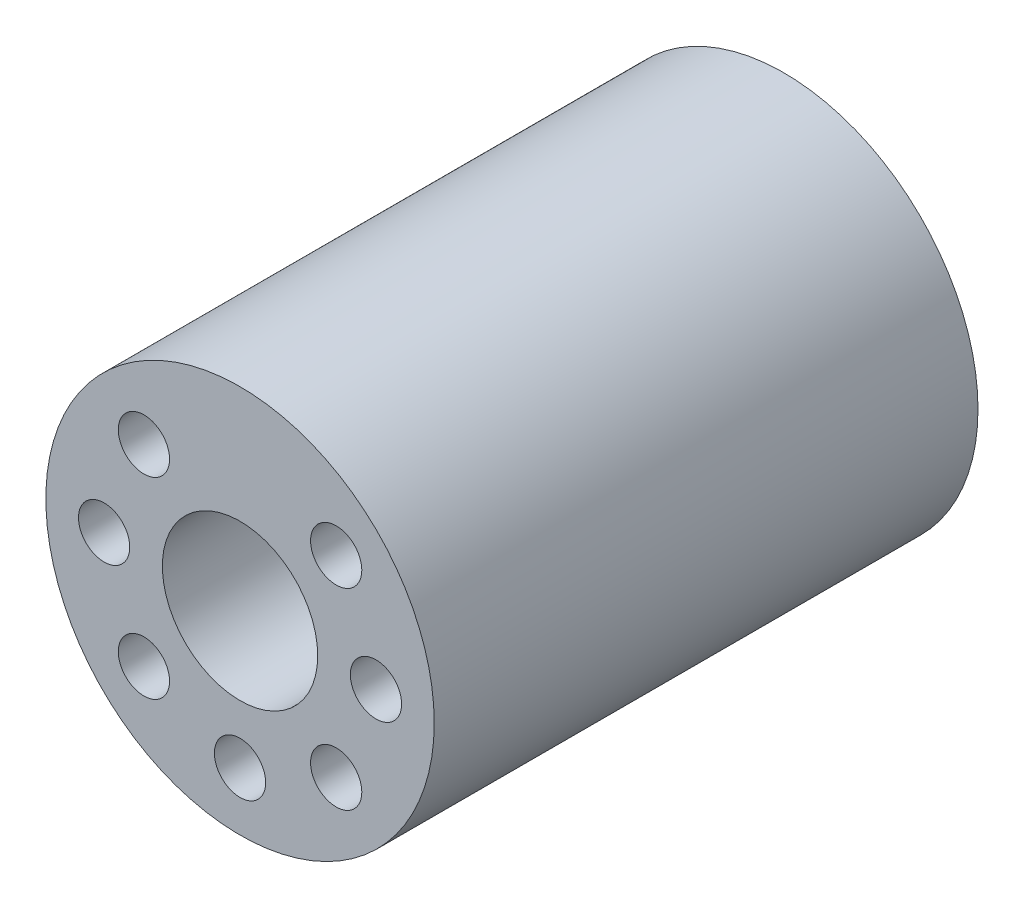
from build123d import *

# Parameters (mm, degrees)
SKETCH1_R           = 25
SKETCH1_R_2         = 10
BOSS_EXTRUDE1_DEPTH = 70
SKETCH3_R           = 3.3
CUT_EXTRUDE1_DEPTH  = 20
CUT_EXTRUDE2_START  = -20
SKETCH4_R           = 3.3
CUT_EXTRUDE2_DEPTH  = 20


with BuildPart() as part:
    # Sketch1 → Boss-Extrude1 (new body)
    with BuildSketch(Plane.XY):
        Circle(SKETCH1_R)
        Circle(SKETCH1_R_2, mode=Mode.SUBTRACT)
    extrude(amount=BOSS_EXTRUDE1_DEPTH)

    # Sketch3 → Cut-Extrude1 (cut)
    with BuildSketch(Plane.XY.offset(70)):
        with Locations((12.374368671, 12.374368671)):
            Circle(SKETCH3_R)
        with Locations((17.5, 0)):
            Circle(SKETCH3_R)
        with Locations((12.374368671, -12.374368671)):
            Circle(SKETCH3_R)
        with Locations((0, -17.5)):
            Circle(SKETCH3_R)
        with Locations((-12.374368671, -12.374368671)):
            Circle(SKETCH3_R)
        with Locations((-17.5, 0)):
            Circle(SKETCH3_R)
        with Locations((-12.374368671, 12.374368671)):
            Circle(SKETCH3_R)
    extrude(amount=-CUT_EXTRUDE1_DEPTH, mode=Mode.SUBTRACT)

    # Sketch4 → Cut-Extrude2 (cut)
    with BuildSketch(Plane(origin=(0, 0, 0), x_dir=(-1, 0, 0), z_dir=(0, 0, -1)).offset(CUT_EXTRUDE2_START)):
        with Locations((0, 17.5)):
            Circle(SKETCH4_R)
        with Locations(Location((12.374368671, 12.374368671, 0), (0, 0, 180))):
            Circle(SKETCH4_R)
        with Locations(Location((17.5, 0, 0), (0, 0, 180))):
            Circle(SKETCH4_R)
        with Locations(Location((12.374368671, -12.374368671, 0), (0, 0, 180))):
            Circle(SKETCH4_R)
        with Locations(Location((0, -17.5, 0), (0, 0, 180))):
            Circle(SKETCH4_R)
        with Locations(Location((-12.374368671, -12.374368671, 0), (0, 0, 180))):
            Circle(SKETCH4_R)
        with Locations(Location((-17.5, 0, 0), (0, 0, 180))):
            Circle(SKETCH4_R)
        with Locations(Location((-12.374368671, 12.374368671, 0), (0, 0, 180))):
            Circle(SKETCH4_R)
    extrude(amount=CUT_EXTRUDE2_DEPTH, mode=Mode.SUBTRACT)


solid = part.part
